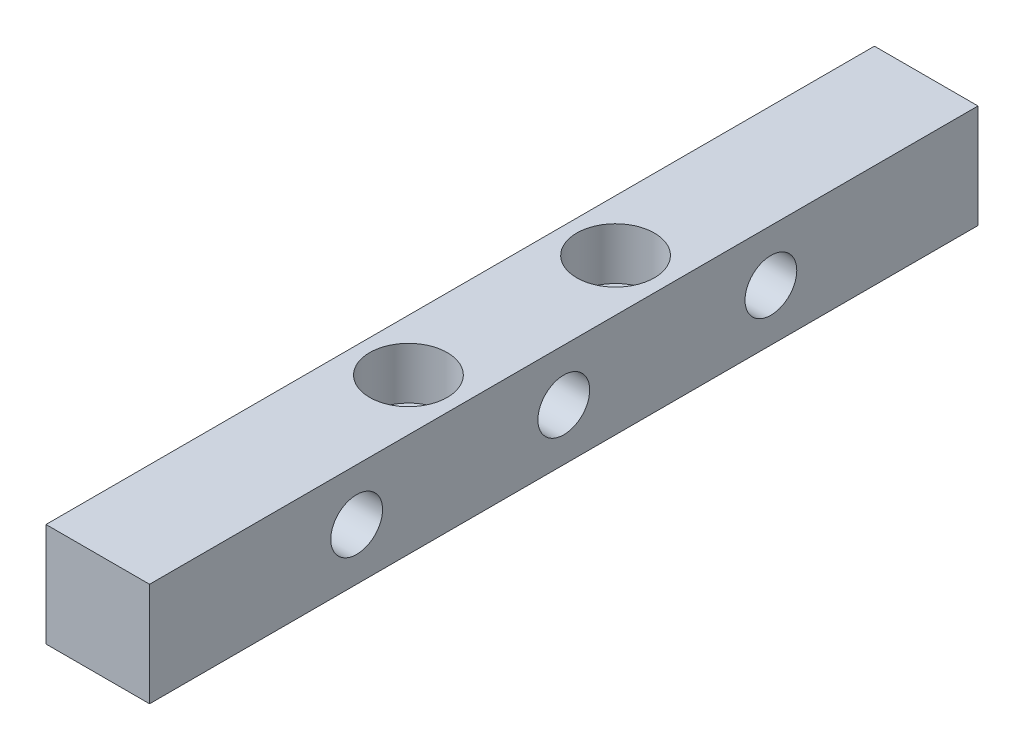
from build123d import *

# Parameters (mm, degrees)
SKETCH2_W                            = 12.7
SKETCH2_H                            = 12.7
BOSS_EXTRUDE1_DEPTH                  = 50.8
F_1_4_20_THREADED_C_BORE_D           = 6.35
F_1_4_20_THREADED_C_BORE_CBORE_D     = 9.525
F_1_4_20_THREADED_C_BORE_CBORE_DEPTH = 6.35
F_1_4_20_THREADED_HOLE_D             = 6.35


with BuildPart() as part:
    # Sketch2 → Boss-Extrude1 (new, symmetric)
    with BuildSketch(Plane.XY):
        Rectangle(SKETCH2_W, SKETCH2_H)
    extrude(amount=BOSS_EXTRUDE1_DEPTH, both=True)

    # 1/4"-20 threaded C-Bore (through all)
    with Locations(Plane(origin=(0, 6.35, 0), x_dir=(1, 0, 0), z_dir=(0, 1, 0))):
        with Locations((0, 12.7), (0, -12.7)):
            CounterBoreHole(F_1_4_20_THREADED_C_BORE_D / 2, F_1_4_20_THREADED_C_BORE_CBORE_D / 2, F_1_4_20_THREADED_C_BORE_CBORE_DEPTH)

    # 1/4"-20 threaded hole (through all)
    with Locations(Plane(origin=(6.35, 0, 0), x_dir=(0, 0, -1), z_dir=(1, 0, 0))):
        with Locations((-25.4, 0), (0, 0), (25.4, 0)):
            Hole(F_1_4_20_THREADED_HOLE_D / 2)


solid = part.part
